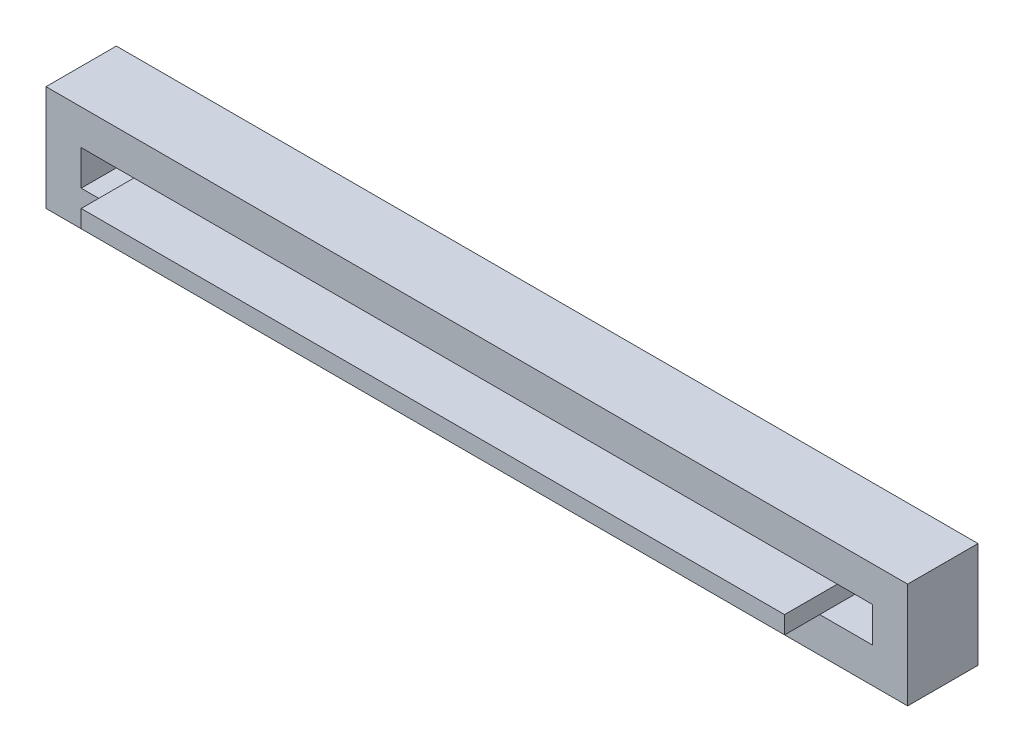
from build123d import *

# Parameters (mm, degrees)
SKETCH1_W           = 45
SKETCH1_H           = 2
BOSS_EXTRUDE1_DEPTH = 2
SKETCH1_3_W         = 49
SKETCH1_3_H         = 6
SKETCH1_3_W_2       = 45
SKETCH1_3_H_2       = 2
BOSS_EXTRUDE2_DEPTH = 4
SKETCH2_W           = 40
SKETCH2_H           = 1
BOSS_EXTRUDE3_DEPTH = 4.5


with BuildPart() as part:
    # Sketch1 → Boss-Extrude1 (new body)
    with BuildSketch(Plane.XY):
        Rectangle(SKETCH1_W, SKETCH1_H)
    extrude(amount=BOSS_EXTRUDE1_DEPTH)

    # Sketch1<3> → Boss-Extrude2 (add)
    with BuildSketch(Plane.XY):
        Rectangle(SKETCH1_3_W, SKETCH1_3_H)
        Rectangle(SKETCH1_3_W_2, SKETCH1_3_H_2, mode=Mode.SUBTRACT)
    extrude(amount=BOSS_EXTRUDE2_DEPTH)

    # Sketch2 → Boss-Extrude3 (add)
    with BuildSketch(Plane.XY.offset(2)):
        Rectangle(SKETCH2_W, SKETCH2_H)
    extrude(amount=BOSS_EXTRUDE3_DEPTH)


solid = part.part
